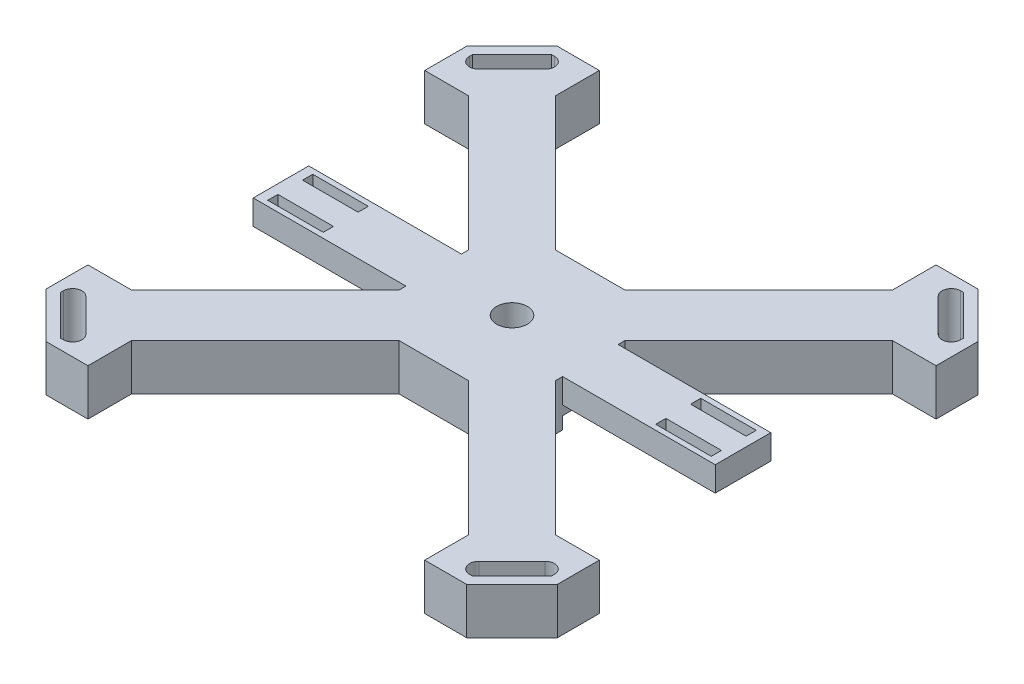
from build123d import *

# Parameters (mm, degrees)
SKETCH1_R           = 2.5
BOSS_EXTRUDE1_DEPTH = 7.5
FILLET3_R           = 1.5
SKETCH3_W           = 25.4
SKETCH3_H           = 9
CUT_EXTRUDE1_DEPTH  = 2
SKETCH2_W           = 24.748800006
SKETCH2_H           = 9
SKETCH2_W_2         = 9
SKETCH2_H_2         = 1.651
BOSS_EXTRUDE3_DEPTH = 3
SKETCH4_W           = 24.748800006
SKETCH4_H           = 9
BOSS_EXTRUDE4_DEPTH = 1


with BuildPart() as part:
    # Sketch1 → Boss-Extrude1 (new body)
    with BuildSketch(Plane(origin=(0, 0, 0), x_dir=(1, 0, 0), z_dir=(0, 1, 0))):
        Polygon((-41.448800006, 34.091704203), (-34.091704203, 41.448800006), (-27.292890359, 41.448800006), (-27.292890359, 34.363958171), (-5.628932188, 12.7), (5.628932188, 12.7), (27.292890359, 34.363958171), (27.292890359, 41.448800006), (34.091704203, 41.448800006), (41.448800006, 34.091704203), (41.448800006, 27.292890359), (34.363958171, 27.292890359), (12.7, 5.628932188), (12.7, -5.628932188), (34.363958171, -27.292890359), (41.448800006, -27.292890359), (41.448800006, -34.091704203), (34.091704203, -41.448800006), (27.292890359, -41.448800006), (27.292890359, -34.363958171), (5.628932188, -12.7), (-5.628932188, -12.7), (-27.292890359, -34.363958171), (-27.292890359, -41.448800006), (-34.091704203, -41.448800006), (-41.448800006, -34.091704203), (-41.448800006, -27.292890359), (-34.363958171, -27.292890359), (-12.7, -5.628932188), (-12.7, 5.628932188), (-34.363958171, 27.292890359), (-41.448800006, 27.292890359), align=None)
        with Locations(Location((0, 0, 0), (0, 0, 270))):
            Circle(SKETCH1_R, mode=Mode.SUBTRACT)
        Polygon((-39.798800006, 33.408251825), (-33.408251825, 39.798800006), (-29.292890359, 39.798800006), (-39.798800006, 29.292890359), align=None, mode=Mode.SUBTRACT)
        Polygon((-33.408251825, -39.798800006), (-29.292890359, -39.798800006), (-39.798800006, -29.292890359), (-39.798800006, -33.408251825), align=None, mode=Mode.SUBTRACT)
        Polygon((39.798800006, -33.408251825), (39.798800006, -29.292890359), (29.292890359, -39.798800006), (33.408251825, -39.798800006), align=None, mode=Mode.SUBTRACT)
        Polygon((33.408251825, 39.798800006), (39.798800006, 33.408251825), (39.798800006, 29.292890359), (29.292890359, 39.798800006), align=None, mode=Mode.SUBTRACT)
    extrude(amount=BOSS_EXTRUDE1_DEPTH)

    # Fillet3
    fillet3_edges = [part.edges().sort_by_distance(p)[0] for p in [
        (39.798800006, 3.75, 29.292890359),
        (29.292890359, 3.75, 39.798800006),
        (-29.292890359, 3.75, 39.798800006),
        (-39.798800006, 3.75, 29.292890359),
        (-39.798800006, 3.75, -29.292890359),
        (-29.292890359, 3.75, -39.798800006),
        (29.292890359, 3.75, -39.798800006),
        (39.798800006, 3.75, -29.292890359),
    ]]
    fillet(fillet3_edges, radius=FILLET3_R)

    # Sketch3 → Cut-Extrude1 (cut)
    with BuildSketch(Plane.XZ):
        Rectangle(SKETCH3_W, SKETCH3_H)
    extrude(amount=-CUT_EXTRUDE1_DEPTH, mode=Mode.SUBTRACT)

    # Sketch2 → Boss-Extrude3 (add)
    # profile 1 of 2: a face of its own
    with BuildSketch(Plane(origin=(0, 7.5, 0), x_dir=(1, 0, 0), z_dir=(0, 1, 0))):
        with Locations((25.074400003, 0)):
            Rectangle(SKETCH2_W, SKETCH2_H)
        with Locations((31.448800006, 2.8255)):
            Rectangle(SKETCH2_W_2, SKETCH2_H_2, mode=Mode.SUBTRACT)
        with Locations((31.448800006, -2.8255)):
            Rectangle(SKETCH2_W_2, SKETCH2_H_2, mode=Mode.SUBTRACT)
    # profile 2 of 2: a face of its own
    with BuildSketch(Plane(origin=(0, 7.5, 0), x_dir=(1, 0, 0), z_dir=(0, 1, 0))):
        with Locations((-25.074400003, 0)):
            Rectangle(SKETCH2_W, SKETCH2_H)
        with Locations((-31.448800006, 2.8255)):
            Rectangle(SKETCH2_W_2, SKETCH2_H_2, mode=Mode.SUBTRACT)
        with Locations((-31.448800006, -2.8255)):
            Rectangle(SKETCH2_W_2, SKETCH2_H_2, mode=Mode.SUBTRACT)
    extrude(amount=-BOSS_EXTRUDE3_DEPTH)

    # Sketch4 → Boss-Extrude4 (add)
    with BuildSketch(Plane.XZ.offset(-4.5)):
        with Locations((25.074400003, 0)):
            Rectangle(SKETCH4_W, SKETCH4_H)
        with Locations((-25.074400003, 0)):
            Rectangle(SKETCH4_W, SKETCH4_H)
    extrude(amount=BOSS_EXTRUDE4_DEPTH)


solid = part.part
